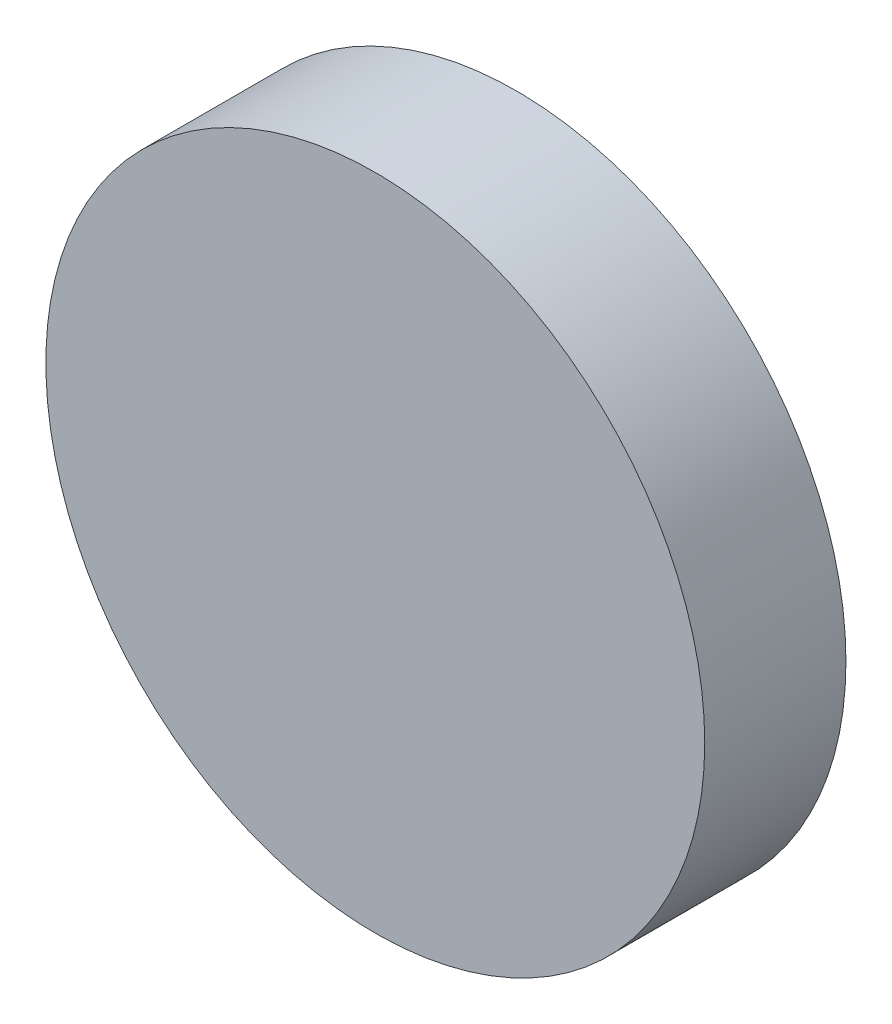
from build123d import *

# Parameters (mm, degrees)
SKETCH1_R           = 140
BOSS_EXTRUDE1_DEPTH = 60


with BuildPart() as part:
    # Sketch1 → Boss-Extrude1 (new body)
    with BuildSketch(Plane.XY):
        Circle(SKETCH1_R)
    extrude(amount=BOSS_EXTRUDE1_DEPTH)


solid = part.part
